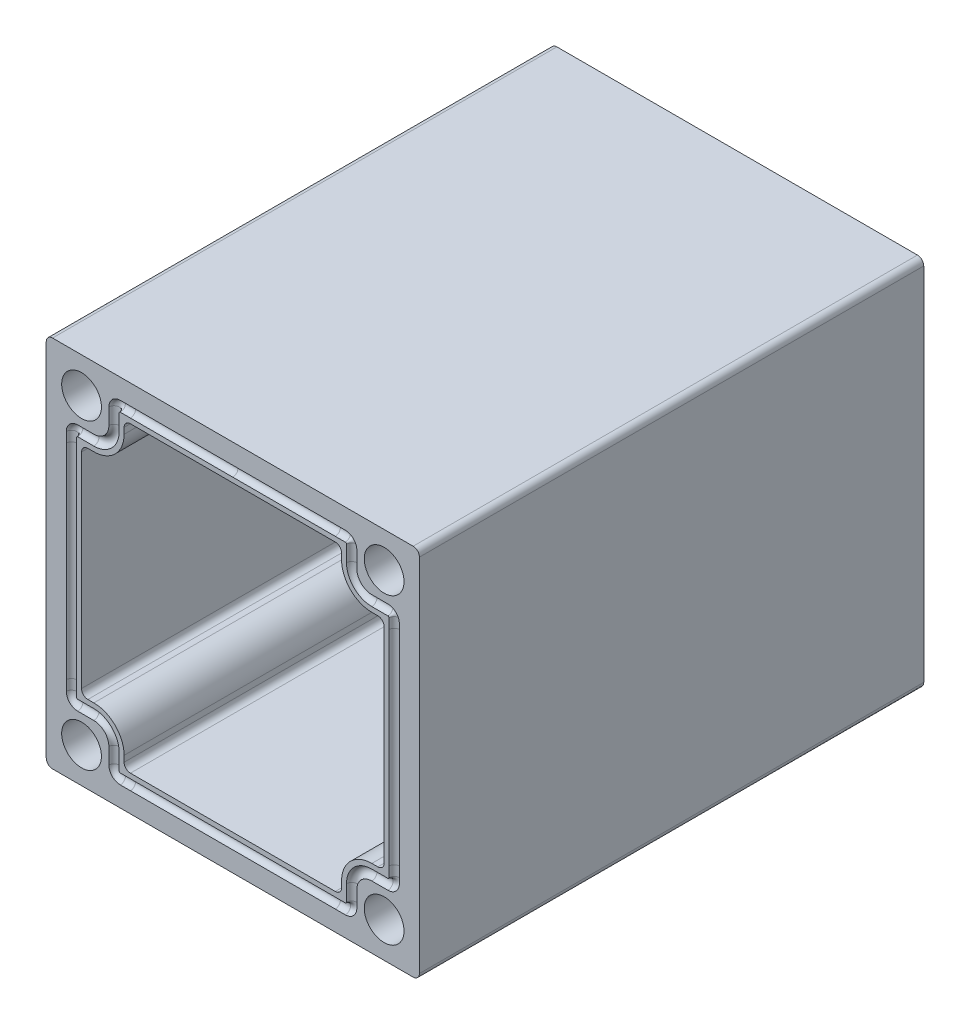
from build123d import *

# Parameters (mm, degrees)
BOSS_EXTRUDE1_DEPTH = 63.5
SKETCH7_R           = 0.65
SKETCH10_R          = 2.5019
CUT_EXTRUDE3_DEPTH  = 12.7
BOSS_EXTRUDE2_START = -60.325
SKETCH12_R          = 10.414
BOSS_EXTRUDE2_DEPTH = 3.175


with BuildPart() as part:
    # Sketch1 → Boss-Extrude1 (new body)
    with BuildSketch(Plane.XY):
        with BuildLine():
            Line((23.495, 22.70125), (23.495, -22.70125))
            ThreePointArc((23.495, -22.70125), (23.262516008, -23.262516008), (22.70125, -23.495))
            Line((22.70125, -23.495), (-22.70125, -23.495))
            ThreePointArc((-22.70125, -23.495), (-23.262516008, -23.262516008), (-23.495, -22.70125))
            Line((-23.495, -22.70125), (-23.495, 22.70125))
            ThreePointArc((-23.495, 22.70125), (-23.262516008, 23.262516008), (-22.70125, 23.495))
            Line((-22.70125, 23.495), (22.70125, 23.495))
            ThreePointArc((22.70125, 23.495), (23.262516008, 23.262516008), (23.495, 22.70125))
        make_face()
        with BuildLine():
            Line((-12.89685, -19.05), (12.89685, -19.05))
            ThreePointArc((12.89685, -19.05), (13.458116008, -18.817516008), (13.6906, -18.25625))
            Line((13.6906, -18.25625), (13.6906, -17.5006))
            ThreePointArc((13.6906, -17.5006), (14.806523164, -14.806523164), (17.5006, -13.6906))
            Line((17.5006, -13.6906), (18.25625, -13.6906))
            ThreePointArc((18.25625, -13.6906), (18.817516008, -13.458116008), (19.05, -12.89685))
            Line((19.05, -12.89685), (19.05, 12.89685))
            ThreePointArc((19.05, 12.89685), (18.817516008, 13.458116008), (18.25625, 13.6906))
            Line((18.25625, 13.6906), (17.5006, 13.6906))
            ThreePointArc((17.5006, 13.6906), (14.806523164, 14.806523164), (13.6906, 17.5006))
            Line((13.6906, 17.5006), (13.6906, 18.25625))
            ThreePointArc((13.6906, 18.25625), (13.458116008, 18.817516008), (12.89685, 19.05))
            Line((12.89685, 19.05), (-12.89685, 19.05))
            ThreePointArc((-12.89685, 19.05), (-13.458116008, 18.817516008), (-13.6906, 18.25625))
            Line((-13.6906, 18.25625), (-13.6906, 17.5006))
            ThreePointArc((-13.6906, 17.5006), (-14.806523164, 14.806523164), (-17.5006, 13.6906))
            Line((-17.5006, 13.6906), (-18.25625, 13.6906))
            ThreePointArc((-18.25625, 13.6906), (-18.817516008, 13.458116008), (-19.05, 12.89685))
            Line((-19.05, 12.89685), (-19.05, -12.89685))
            ThreePointArc((-19.05, -12.89685), (-18.817516008, -13.458116008), (-18.25625, -13.6906))
            Line((-18.25625, -13.6906), (-17.5006, -13.6906))
            ThreePointArc((-17.5006, -13.6906), (-14.806523164, -14.806523164), (-13.6906, -17.5006))
            Line((-13.6906, -17.5006), (-13.6906, -18.25625))
            ThreePointArc((-13.6906, -18.25625), (-13.458116008, -18.817516008), (-12.89685, -19.05))
        make_face(mode=Mode.SUBTRACT)
    extrude(amount=-BOSS_EXTRUDE1_DEPTH)

    # Cut-Sweep2: sweep along a path in Sketch11
    with BuildLine(Plane.XY) as cut_sweep2_path:
        Line((-14.9606, 19.52625), (-14.9606, 17.5006))
        ThreePointArc((-14.9606, 17.5006), (-15.704548776, 15.704548776), (-17.5006, 14.9606))
        Line((-17.5006, 14.9606), (-19.52625, 14.9606))
        ThreePointArc((-19.52625, 14.9606), (-20.087516008, 14.728116008), (-20.32, 14.16685))
        Line((-20.32, 14.16685), (-20.32, 12.89685))
        Line((-20.32, 12.89685), (-20.32, -12.89685))
        Line((-20.32, -12.89685), (-20.32, -14.16685))
        ThreePointArc((-20.32, -14.16685), (-20.087516008, -14.728116008), (-19.52625, -14.9606))
        Line((-19.52625, -14.9606), (-17.5006, -14.9606))
        ThreePointArc((-17.5006, -14.9606), (-15.704548776, -15.704548776), (-14.9606, -17.5006))
        Line((-14.9606, -17.5006), (-14.9606, -19.52625))
        ThreePointArc((-14.9606, -19.52625), (-14.728116008, -20.087516008), (-14.16685, -20.32))
        Line((-14.16685, -20.32), (-12.89685, -20.32))
        Line((-12.89685, -20.32), (12.89685, -20.32))
        Line((12.89685, -20.32), (14.16685, -20.32))
        ThreePointArc((14.16685, -20.32), (14.728116008, -20.087516008), (14.9606, -19.52625))
        Line((14.9606, -19.52625), (14.9606, -17.5006))
        ThreePointArc((14.9606, -17.5006), (15.704548776, -15.704548776), (17.5006, -14.9606))
        Line((17.5006, -14.9606), (19.52625, -14.9606))
        ThreePointArc((19.52625, -14.9606), (20.087516008, -14.728116008), (20.32, -14.16685))
        Line((20.32, -14.16685), (20.32, -12.89685))
        Line((20.32, -12.89685), (20.32, 12.89685))
        Line((20.32, 12.89685), (20.32, 14.16685))
        ThreePointArc((20.32, 14.16685), (20.087516008, 14.728116008), (19.52625, 14.9606))
        Line((19.52625, 14.9606), (17.5006, 14.9606))
        ThreePointArc((17.5006, 14.9606), (15.704548776, 15.704548776), (14.9606, 17.5006))
        Line((14.9606, 17.5006), (14.9606, 19.52625))
        ThreePointArc((14.9606, 19.52625), (14.728116008, 20.087516008), (14.16685, 20.32))
        Line((14.16685, 20.32), (12.89685, 20.32))
        Line((12.89685, 20.32), (-12.89685, 20.32))
        Line((-12.89685, 20.32), (-14.16685, 20.32))
        ThreePointArc((-14.16685, 20.32), (-14.728116008, 20.087516008), (-14.9606, 19.52625))
    # Sketch7 → Cut-Sweep2 (sweep, cut)
    with BuildSketch(Plane(origin=(0, 0, 0), x_dir=(0, 0, -1), z_dir=(1, 0, 0))):
        with Locations((0, 20.32)):
            Circle(SKETCH7_R)
    sweep(path=cut_sweep2_path.line, mode=Mode.SUBTRACT)

    # Sketch10 → Cut-Extrude3 (cut)
    with BuildSketch(Plane.XY):
        with Locations((19.05, 19.05)):
            Circle(SKETCH10_R)
        with Locations((19.05, -19.05)):
            Circle(SKETCH10_R)
        with Locations((-19.05, -19.05)):
            Circle(SKETCH10_R)
        with Locations((-19.05, 19.05)):
            Circle(SKETCH10_R)
    extrude(amount=-CUT_EXTRUDE3_DEPTH, mode=Mode.SUBTRACT)

    # Sketch12 → Boss-Extrude2 (add)
    with BuildSketch(Plane.XY.offset(BOSS_EXTRUDE2_START)):
        with BuildLine():
            Line((23.495, 22.70125), (23.495, -22.70125))
            ThreePointArc((23.495, -22.70125), (23.262516008, -23.262516008), (22.70125, -23.495))
            Line((22.70125, -23.495), (-22.70125, -23.495))
            ThreePointArc((-22.70125, -23.495), (-23.262516008, -23.262516008), (-23.495, -22.70125))
            Line((-23.495, -22.70125), (-23.495, 22.70125))
            ThreePointArc((-23.495, 22.70125), (-23.262516008, 23.262516008), (-22.70125, 23.495))
            Line((-22.70125, 23.495), (22.70125, 23.495))
            ThreePointArc((22.70125, 23.495), (23.262516008, 23.262516008), (23.495, 22.70125))
        make_face()
        Circle(SKETCH12_R, mode=Mode.SUBTRACT)
    extrude(amount=-BOSS_EXTRUDE2_DEPTH)


solid = part.part
